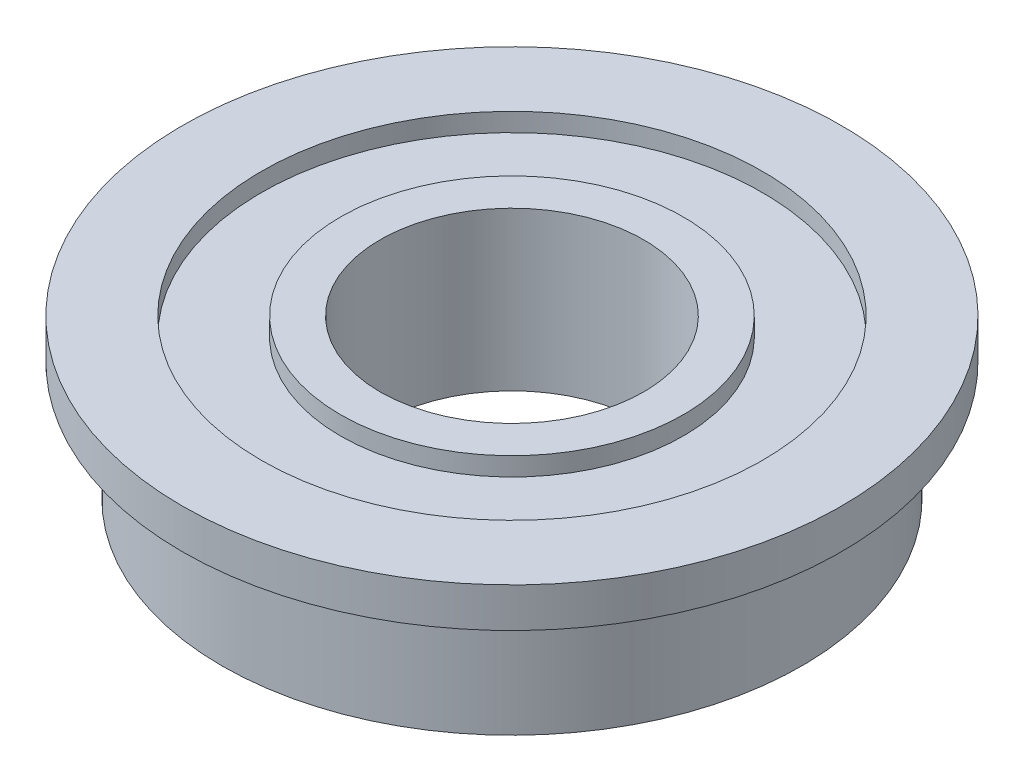
from build123d import *

# Parameters (mm, degrees)
SKETCH_2_R      = 12.5
SKETCH_2_R_2    = 11
EXTRUDE_1_DEPTH = 1.5


with BuildPart() as part:
    # 草图1 → 旋转1 (revolve)
    with BuildSketch(Plane.XY, mode=Mode.PRIVATE) as revolve_1_sk:
        Polygon((5, 6), (5, 0), (6.5, 0), (6.5, 0.7), (9.5, 0.7), (9.5, 0), (11, 0), (11, 6), (9.5, 6), (9.5, 5.3), (6.5, 5.3), (6.5, 6), align=None)
    revolve(revolve_1_sk.sketch.rotate(Axis((0, 4.611296038, 0), (0, -1, 0)), 90), axis=Axis((0, 4.611296038, 0), (0, -1, 0)))

    # 草图2 → 凸台-拉伸1 (add)
    with BuildSketch(Plane(origin=(0, 6, 0), x_dir=(1, 0, 0), z_dir=(0, 1, 0))):
        with Locations(Location((0, 0, 0), (0, 0, 270))):
            Circle(SKETCH_2_R)
        with Locations(Location((0, 0, 0), (0, 0, 270))):
            Circle(SKETCH_2_R_2, mode=Mode.SUBTRACT)
    extrude(amount=-EXTRUDE_1_DEPTH)


solid = part.part
